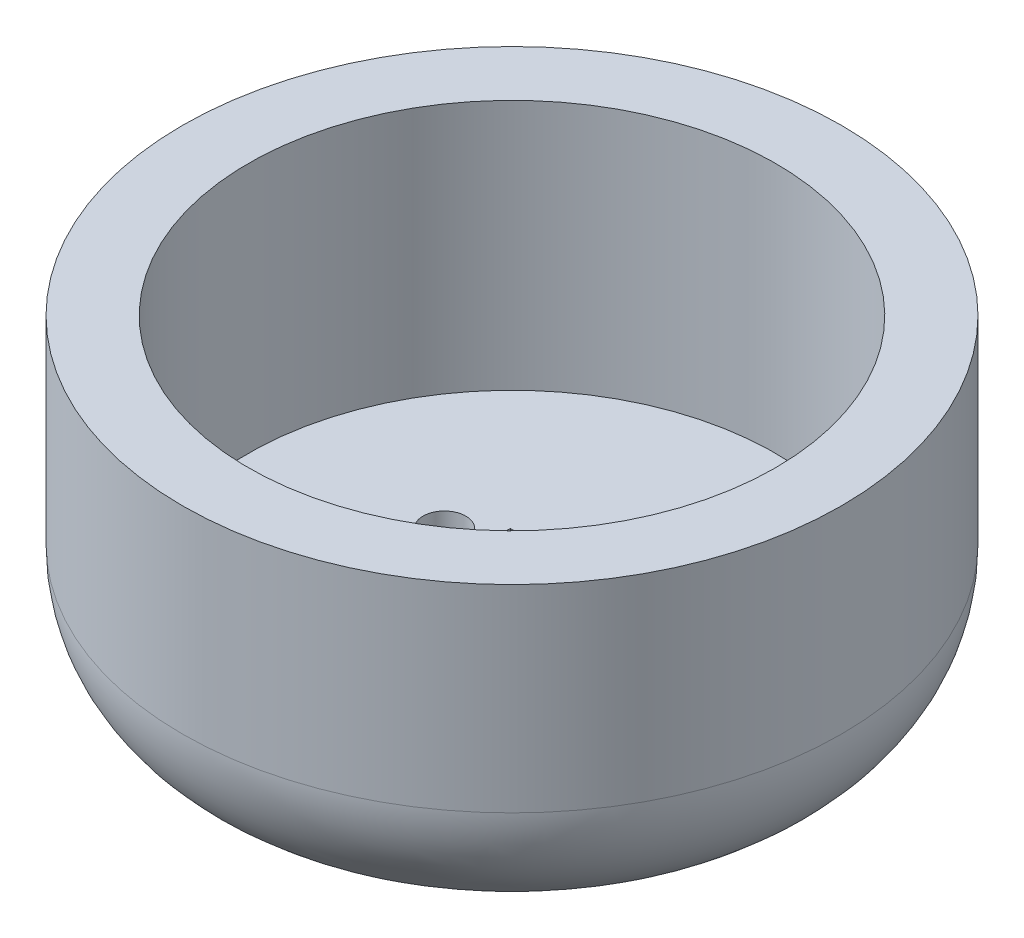
from build123d import *

# Parameters (mm, degrees)
FILLET1_R          = 20
SKETCH6_W          = 39.5
SKETCH6_H          = 20
SKETCH6_R          = 6.375
CUT_EXTRUDE1_DEPTH = 9.9
SKETCH8_R          = 6.375
CUT_EXTRUDE2_DEPTH = 37.9
SKETCH9_R          = 3.25
CUT_EXTRUDE3_DEPTH = 37.9


with BuildPart() as part:
    # Sketch5 → Revolve1 (revolve)
    with BuildSketch(Plane.XY, mode=Mode.PRIVATE) as revolve1_sk:
        Polygon((0, 0), (-50, 0), (-50, 50), (-40, 50), (-40, 11.9), (0, 11.9), align=None)
    revolve(revolve1_sk.sketch.rotate(Axis((0, 0, 0), (0, 1, 0)), 180), axis=Axis((0, 0, 0), (0, 1, 0)))

    # Fillet1
    fillet1_edges = [part.edges().sort_by_distance(p)[0] for p in [
        (-50, 0, 0),
    ]]
    fillet(fillet1_edges, radius=FILLET1_R)

    # Sketch6 → Cut-Extrude1 (cut)
    with BuildSketch(Plane(origin=(0, 11.9, 0), x_dir=(1, 0, 0), z_dir=(0, 1, 0))):
        with Locations((9.5, 0)):
            Rectangle(SKETCH6_W, SKETCH6_H)
        with Locations(Location((0, 0, 0), (0, 0, 180))):
            Circle(SKETCH6_R, mode=Mode.SUBTRACT)
    extrude(amount=-CUT_EXTRUDE1_DEPTH, mode=Mode.SUBTRACT)

    # Sketch8 → Cut-Extrude2 (cut)
    with BuildSketch(Plane(origin=(0, 11.9, 0), x_dir=(1, 0, 0), z_dir=(0, 1, 0))):
        with Locations(Location((0, 0, 0), (0, 0, 270))):
            Circle(SKETCH8_R)
    extrude(amount=-CUT_EXTRUDE2_DEPTH, mode=Mode.SUBTRACT)

    # Sketch9 → Cut-Extrude3 (cut)
    with BuildSketch(Plane(origin=(0, 11.9, 0), x_dir=(1, 0, 0), z_dir=(0, 1, 0))):
        with Locations(Location((-15.25, 5, 0), (0, 0, 180))):
            Circle(SKETCH9_R)
        with Locations(Location((34.25, 5, 0), (0, 0, 131.634247299))):
            Circle(SKETCH9_R)
        with Locations(Location((34.25, -5, 0), (0, 0, 180))):
            Circle(SKETCH9_R)
        with Locations((-15.25, -5)):
            Circle(SKETCH9_R)
    extrude(amount=-CUT_EXTRUDE3_DEPTH, mode=Mode.SUBTRACT)


solid = part.part
